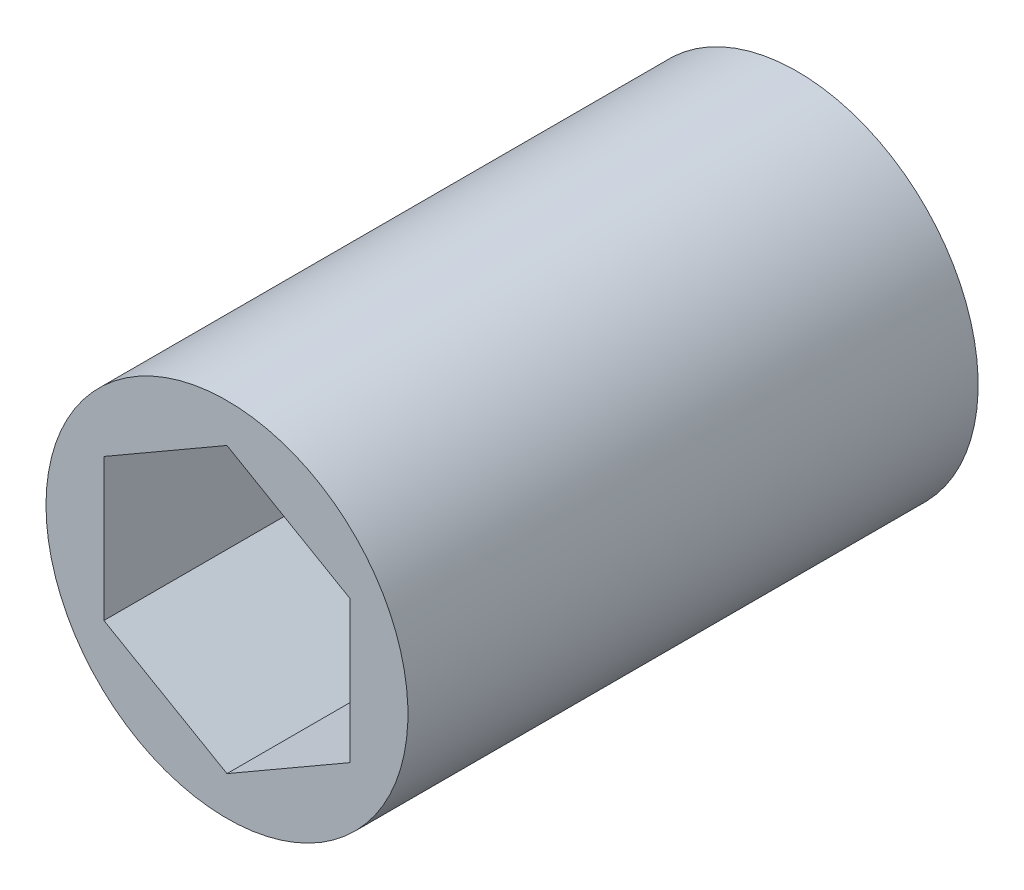
from build123d import *

# Parameters (mm, degrees)
SKETCH1_R           = 9.525
BOSS_EXTRUDE1_DEPTH = 30.01264


with BuildPart() as part:
    # Sketch1 → Boss-Extrude1 (new body)
    with BuildSketch(Plane.XY):
        with Locations(Location((0, 0, 0), (0, 0, 180))):
            Circle(SKETCH1_R)
        Polygon((0, 7.478995387), (-6.477, 3.739497694), (-6.477, -3.739497694), (0, -7.478995387), (6.477, -3.739497694), (6.477, 3.739497694), align=None, mode=Mode.SUBTRACT)
    extrude(amount=BOSS_EXTRUDE1_DEPTH)


solid = part.part
